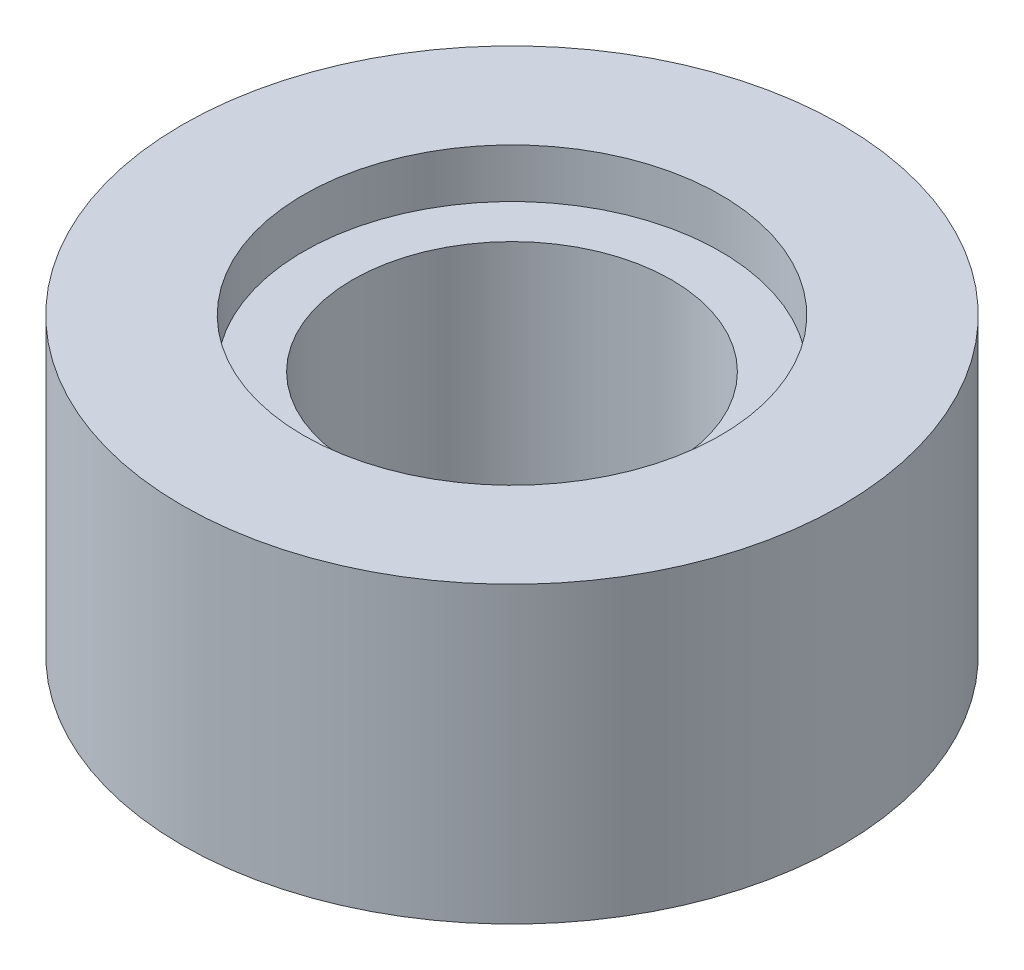
from build123d import *

# Parameters (mm, degrees)
SKETCH1_R           = 8.5
SKETCH1_R_2         = 6.5
BOSS_EXTRUDE1_DEPTH = 10
SKETCH2_R           = 11.15
SKETCH2_R_2         = 8.5
BOSS_EXTRUDE2_DEPTH = 2
SKETCH3_R           = 13.443954772
SKETCH3_R_2         = 11.15
BOSS_EXTRUDE3_DEPTH = 12


with BuildPart() as part:
    # Sketch1 → Boss-Extrude1 (new body)
    with BuildSketch(Plane(origin=(0, 0, 0), x_dir=(1, 0, 0), z_dir=(0, 1, 0))):
        with Locations(Location((0, 0, 0), (0, 0, 270))):
            Circle(SKETCH1_R)
        with Locations(Location((0, 0, 0), (0, 0, 270))):
            Circle(SKETCH1_R_2, mode=Mode.SUBTRACT)
    extrude(amount=BOSS_EXTRUDE1_DEPTH)


with BuildPart() as body_2:
    # Sketch2 → Boss-Extrude2 (new body)
    with BuildSketch(Plane(origin=(0, 10, 0), x_dir=(1, 0, 0), z_dir=(0, 1, 0))):
        with Locations(Location((0, 0, 0), (0, 0, 270))):
            Circle(SKETCH2_R)
        with Locations(Location((0, 0, 0), (0, 0, 270))):
            Circle(SKETCH2_R_2, mode=Mode.SUBTRACT)
    extrude(amount=BOSS_EXTRUDE2_DEPTH)

    # Sketch3 → Boss-Extrude3 (add)
    with BuildSketch(Plane(origin=(0, 12, 0), x_dir=(1, 0, 0), z_dir=(0, 1, 0))):
        with Locations(Location((0, 0, 0), (0, 0, 270))):
            Circle(SKETCH3_R)
        with Locations(Location((0, 0, 0), (0, 0, 270))):
            Circle(SKETCH3_R_2, mode=Mode.SUBTRACT)
    extrude(amount=-BOSS_EXTRUDE3_DEPTH)


solid = Compound([part.part, body_2.part])
